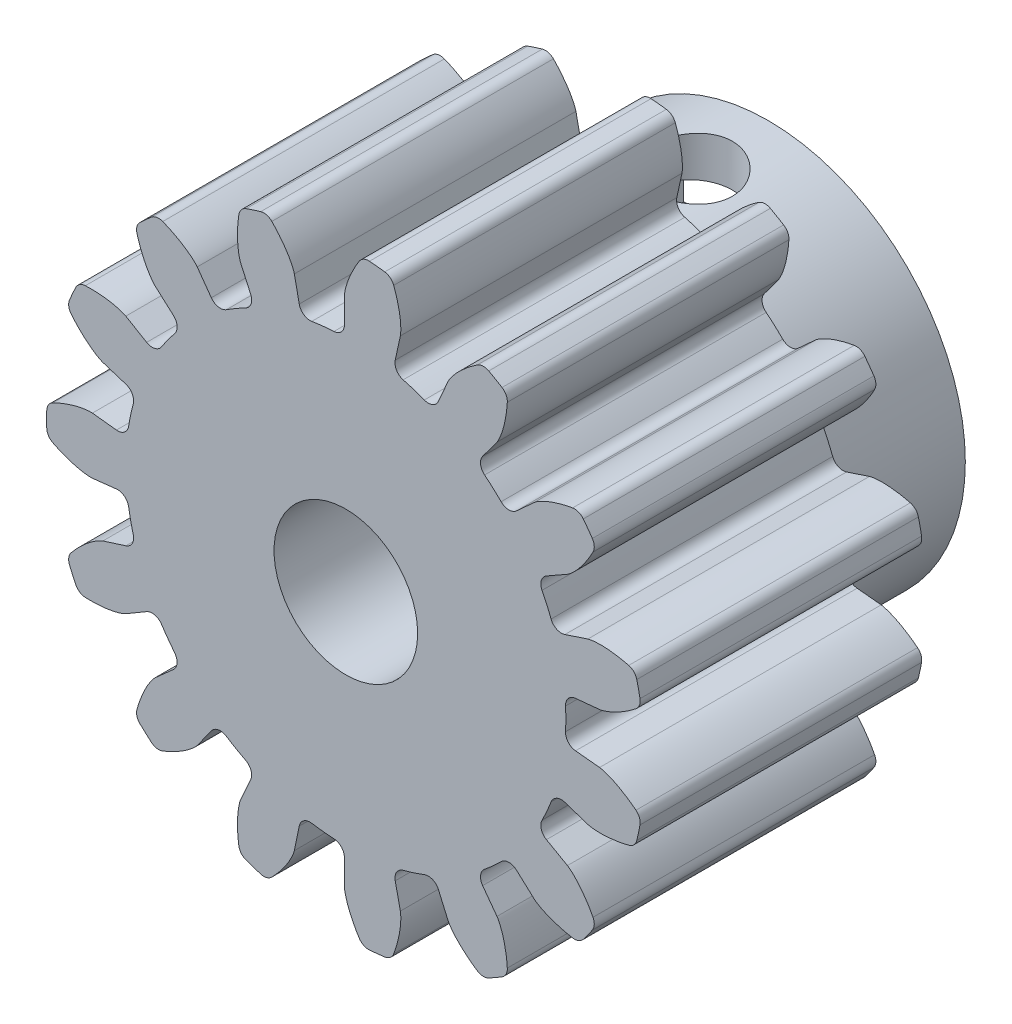
from build123d import *

# Parameters (mm, degrees)
SKETCH1_R                = 10.625
BOSS_EXTRUDE1_DEPTH      = 10
CUT_EXTRUDE1_DEPTH       = 19.049411348
FILLET1_R                = 0.393380952
CIRPATTERN1_COUNT        = 15
FILLET1_OF_CIRPATTERN1_R = 0.393380952
SKETCH4_R                = 7
BOSS_EXTRUDE2_DEPTH      = 5
CUT_EXTRUDE2_DEPTH       = 19.030622175
CUT_EXTRUDE2_DEPTH_BACK  = 19.030622175
SKETCH3_R                = 2.55
SKETCH5_R                = 1.525
CUT_EXTRUDE3_DEPTH       = 19.030622175
CUT_EXTRUDE4_START       = 5.5
CUT_EXTRUDE4_DEPTH       = 2.5


with BuildPart() as part:
    # Sketch1 → Boss-Extrude1 (new body)
    with BuildSketch(Plane.XY):
        Circle(SKETCH1_R)
    extrude(amount=BOSS_EXTRUDE1_DEPTH)

    # Sketch2 → Cut-Extrude1 (cut, through all)
    with BuildSketch(Plane.XY.offset(10)):
        with BuildLine():
            Line((7.774577457, 0.768831327), (9.011598185, 0.891160842))
            add(Edge.make_bspline(
                [(9.011598185, 0.891160842), (9.01410441, 0.891441585), (9.021122589, 0.892329799), (9.034345103, 0.894406893), (9.055846042, 0.898360066), (9.083123696, 0.90422467), (9.11823015, 0.912752748), (9.159378442, 0.924015509), (9.204363776, 0.937663911), (9.253033007, 0.953880107), (9.301331713, 0.971263786), (9.349260085, 0.989723397), (9.396768006, 1.009118637), (9.454021301, 1.033797516), (9.522255176, 1.065034574), (9.601361943, 1.103929125), (9.69028646, 1.150844348), (9.780013833, 1.201635313), (9.867547131, 1.254053085), (9.955065756, 1.309796489), (10.03908783, 1.365701375), (10.125357376, 1.426590516), (10.204481957, 1.484231655), (10.291964344, 1.55190327), (10.362227476, 1.607420568), (10.433800857, 1.667328009), (10.468485629, 1.696861768), (10.486147639, 1.712113516)],
                knots=[0, 0, 0, 0, 0, 0.005376749, 0.015083688, 0.02853182, 0.04661014, 0.064854849, 0.092110526, 0.119476176, 0.146842496, 0.174208854, 0.201574956, 0.228941013, 0.256307345, 0.307035032, 0.361767352, 0.416499661, 0.471231937, 0.525964282, 0.580696616, 0.635428982, 0.690161387, 0.744893688, 0.799626082, 0.854358407, 0.909090915, 0.909090915, 0.909090915, 0.909090915, 0.909090915], degree=4))
            ThreePointArc((10.486147639, 1.712113516), (10.696633059, 0), (10.486147639, -1.712113516))
            add(Edge.make_bspline(
                [(9.011598185, -0.891160842), (9.01410441, -0.891441585), (9.021122589, -0.892329799), (9.034345103, -0.894406893), (9.055846042, -0.898360066), (9.083123696, -0.90422467), (9.11823015, -0.912752748), (9.159378442, -0.924015509), (9.204363776, -0.937663911), (9.253033007, -0.953880107), (9.301331713, -0.971263786), (9.349260085, -0.989723397), (9.396768006, -1.009118637), (9.454021301, -1.033797516), (9.522255176, -1.065034574), (9.601361943, -1.103929125), (9.69028646, -1.150844348), (9.780013833, -1.201635313), (9.867547131, -1.254053085), (9.955065756, -1.309796489), (10.03908783, -1.365701375), (10.125357376, -1.426590516), (10.204481957, -1.484231655), (10.291964344, -1.55190327), (10.362227476, -1.607420568), (10.433800857, -1.667328009), (10.468485629, -1.696861768), (10.486147639, -1.712113516)],
                knots=[0, 0, 0, 0, 0, 0.005376749, 0.015083688, 0.02853182, 0.04661014, 0.064854849, 0.092110526, 0.119476176, 0.146842496, 0.174208854, 0.201574956, 0.228941013, 0.256307345, 0.307035032, 0.361767352, 0.416499661, 0.471231937, 0.525964282, 0.580696616, 0.635428982, 0.690161387, 0.744893688, 0.799626082, 0.854358407, 0.909090915, 0.909090915, 0.909090915, 0.909090915, 0.909090915], degree=4))
            Line((9.011598185, -0.891160842), (7.774577457, -0.768831327))
            ThreePointArc((7.774577457, -0.768831327), (7.8125, 0), (7.774577457, 0.768831327))
        make_face()
    cut_extrude1 = extrude(amount=-CUT_EXTRUDE1_DEPTH, mode=Mode.SUBTRACT)

    # Fillet1
    fillet1_edges = [part.edges().sort_by_distance(p)[0] for p in [
        (7.774577457, -0.768831327, 5),
        (7.774577457, 0.768831327, 5),
        (10.486147639, 1.712113516, 5),
        (10.486147639, -1.712113516, 5),
    ]]
    fillet(fillet1_edges, radius=FILLET1_R)

    # CirPattern1: Cut-Extrude1 ×15 about axis
    cirpattern1_axis = Axis((0, 0, 0), (0, 0, 1))
    for i in range(1, CIRPATTERN1_COUNT):
        add(cut_extrude1.rotate(cirpattern1_axis, i * 360 / CIRPATTERN1_COUNT), mode=Mode.SUBTRACT)

    # Fillet1 of CirPattern1
    fillet1_of_cirpattern1_edges = [part.edges().sort_by_distance(p)[0] for p in [
        (7.415141794, 2.45984317, 5),
        (6.789718048, 3.864567903, 5),
        (8.88319324, 5.829194015, 5),
        (10.275951848, 2.701006964, 5),
        (5.77356075, 5.263188436, 5),
        (4.630854706, 6.29208558, 5),
        (5.744254028, 8.938353912, 5),
        (8.288950628, 6.647098802, 5),
        (3.133678602, 7.156480607, 5),
        (1.671274515, 7.631644498, 5),
        (1.61208111, 10.501991216, 5),
        (4.868714542, 9.44384687, 5),
        (-0.048045046, 7.812352266, 5),
        (-1.577284223, 7.651622752, 5),
        (-2.798835277, 10.24973883, 5),
        (0.606633481, 10.60766802, 5),
        (-3.221461268, 7.117397245, 5),
        (-4.553116189, 6.348565918, 5),
        (-6.725807619, 8.225213485, 5),
        (-3.76034002, 9.937327001, 5),
        (-5.837857572, 5.191779581, 5),
        (-6.741673002, 3.947784363, 5),
        (-9.489826721, 4.778474005, 5),
        (-7.47711657, 7.548731866, 5),
        (-7.444835266, 2.368456062, 5),
        (-7.764533308, 0.864395027, 5),
        (-10.61296857, 0.505492958, 5),
        (-9.901031738, 3.854892414, 5),
        (-7.764533308, -0.864395027, 5),
        (-7.444835266, -2.368456062, 5),
        (-9.901031738, -3.854892414, 5),
        (-10.61296857, -0.505492958, 5),
        (-6.741673002, -3.947784363, 5),
        (-5.837857572, -5.191779581, 5),
        (-7.47711657, -7.548731866, 5),
        (-9.489826721, -4.778474005, 5),
        (-4.553116189, -6.348565918, 5),
        (-3.221461268, -7.117397245, 5),
        (-3.76034002, -9.937327001, 5),
        (-6.725807619, -8.225213485, 5),
        (-1.577284223, -7.651622752, 5),
        (-0.048045046, -7.812352266, 5),
        (0.606633481, -10.60766802, 5),
        (-2.798835277, -10.24973883, 5),
        (1.671274515, -7.631644498, 5),
        (3.133678602, -7.156480607, 5),
        (4.868714542, -9.44384687, 5),
        (1.61208111, -10.501991216, 5),
        (4.630854706, -6.29208558, 5),
        (5.77356075, -5.263188436, 5),
        (8.288950628, -6.647098802, 5),
        (5.744254028, -8.938353912, 5),
        (6.789718048, -3.864567903, 5),
        (7.415141794, -2.45984317, 5),
        (10.275951848, -2.701006964, 5),
        (8.88319324, -5.829194015, 5),
    ]]
    fillet(fillet1_of_cirpattern1_edges, radius=FILLET1_OF_CIRPATTERN1_R)

    # Sketch4 → Boss-Extrude2 (add)
    with BuildSketch(Plane.XY):
        Circle(SKETCH4_R)
    extrude(amount=-BOSS_EXTRUDE2_DEPTH)

    # Sketch3 → Cut-Extrude2 (cut, two sides: drawn at the far end of the back side and taken through both)
    with BuildSketch(Plane.XY.offset(-CUT_EXTRUDE2_DEPTH_BACK)):
        Circle(SKETCH3_R)
    extrude(amount=CUT_EXTRUDE2_DEPTH + CUT_EXTRUDE2_DEPTH_BACK, mode=Mode.SUBTRACT)

    # Sketch5 → Cut-Extrude3 (cut, through all)
    with BuildSketch(Plane(origin=(0, 0, 0), x_dir=(1, 0, 0), z_dir=(0, 1, 0))):
        with Locations(Location((0, 2.2, 0), (0, 0, 90))):
            Circle(SKETCH5_R)
    extrude(amount=CUT_EXTRUDE3_DEPTH, mode=Mode.SUBTRACT)

    # Sketch6 → Cut-Extrude4 (cut)
    with BuildSketch(Plane(origin=(0, 0, 0), x_dir=(1, 0, 0), z_dir=(0, 1, 0)).offset(CUT_EXTRUDE4_START)):
        Polygon((3, 6.838947715), (-3, 6.838947715), (-3, 2.2), (-1.5, 4.798076211), (1.5, 4.798076211), (3, 2.2), align=None)
        Polygon((-1.5, -0.398076211), (1.5, -0.398076211), (3, 2.2), (1.5, 4.798076211), (-1.5, 4.798076211), (-3, 2.2), align=None)
    extrude(amount=-CUT_EXTRUDE4_DEPTH, mode=Mode.SUBTRACT)


solid = part.part
